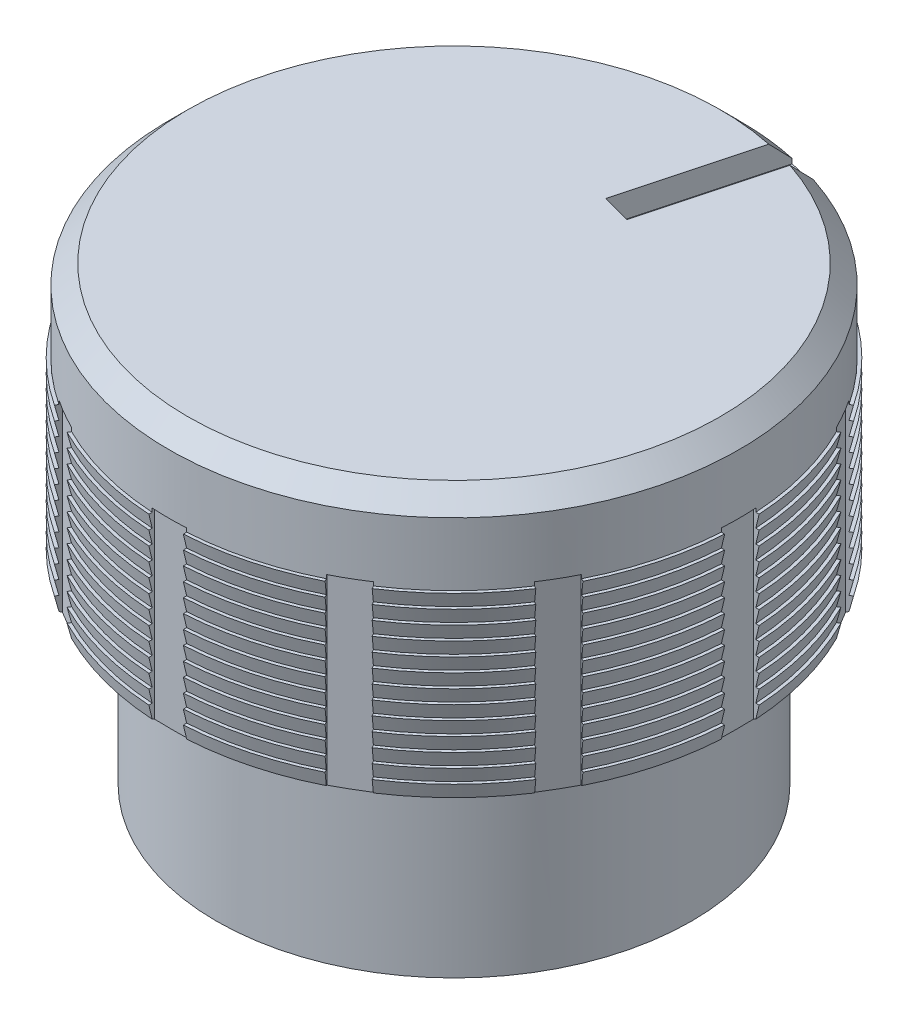
from build123d import *

# Parameters (mm, degrees)
CUT_EXTRUDE_START   = -1.65
SKETCH_3_W          = 0.725430778
SKETCH_3_H          = 1.01974488
SKETCH_3_W_2        = 1.01974488
SKETCH_3_H_2        = 0.725430778
CUT_EXTRUDE_1_DEPTH = 10.35
CHAMFER_1_SIZE      = 0.4
CUT_EXTRUDE_2_DEPTH = 0.5
CUT_EXTRUDE_3_DEPTH = 5


with BuildPart() as part:
    # Эскиз2 → Повернуть1 (revolve)
    with BuildSketch(Plane.XY, mode=Mode.PRIVATE) as revolve_1_sk:
        Polygon((0, 12.425316518), (0, 11.425316518), (2.6, 11.425316518), (2.6, 6.425316518), (3.724689456, 6.425316518), (3.724689456, 2.931277974), (5, 2.931277974), (5, 6.425316518), (6, 6.925316518), (6.07, 7.218411602), (6.0007392, 7.218411602), (6.07, 7.508411602), (6.0007392, 7.508411602), (6.07, 7.798411602), (6.0007392, 7.798411602), (6.07, 8.088411602), (6.0007392, 8.088411602), (6.07, 8.378411602), (6.0007392, 8.378411602), (6.07, 8.668411602), (6.0007392, 8.668411602), (6.07, 8.958411602), (6.0007392, 8.958411602), (6.07, 9.248411602), (6.0007392, 9.248411602), (6.07, 9.538411602), (6.0007392, 9.538411602), (6.07, 9.828411602), (6.0007392, 9.828411602), (6.07, 10.118411602), (6.0007392, 10.118411602), (6.07, 10.408411602), (6.0007392, 10.408411602), (6.07, 10.698411602), (6.0007392, 10.698411602), (6, 10.695316518), (6, 10.698411602), (6, 10.76026554), (6, 10.985316518), (6, 10.988411602), (6, 11.275316518), (6, 11.278411602), (6, 11.565316518), (6, 11.568411602), (6, 11.855316518), (6, 11.858411602), (6, 12.145316518), (6, 12.148411602), (6, 12.425316518), align=None)
    revolve(revolve_1_sk.sketch.rotate(Axis((0, 0, 0), (0, 1, 0)), 90), axis=Axis((0, 0, 0), (0, 1, 0)))

    # Эскиз3 → Вырез-Вытянуть1 (cut)
    with BuildSketch(Plane(origin=(0, 12.425316518, 0), x_dir=(1, 0, 0), z_dir=(0, 1, 0)).offset(CUT_EXTRUDE_START)):
        with Locations((0, 6.446440486)):
            Rectangle(SKETCH_3_W, SKETCH_3_H)
        Polygon((3.792277205, 5.842986016), (3.164035722, 6.205701405), (2.654163282, 5.322576434), (3.282404764, 4.959861044), align=None)
        Polygon((6.205701405, 3.164035722), (5.842986016, 3.792277205), (4.959861044, 3.282404764), (5.322576434, 2.654163282), align=None)
        with Locations((6.446440486, 0)):
            Rectangle(SKETCH_3_W_2, SKETCH_3_H_2)
        Polygon((5.842986016, -3.792277205), (6.205701405, -3.164035722), (5.322576434, -2.654163282), (4.959861044, -3.282404764), align=None)
        Polygon((3.164035722, -6.205701405), (3.792277205, -5.842986016), (3.282404764, -4.959861044), (2.654163282, -5.322576434), align=None)
        with Locations((0, -6.446440486)):
            Rectangle(SKETCH_3_W, SKETCH_3_H)
        Polygon((-3.792277205, -5.842986016), (-3.164035722, -6.205701405), (-2.654163282, -5.322576434), (-3.282404764, -4.959861044), align=None)
        Polygon((-6.205701405, -3.164035722), (-5.842986016, -3.792277205), (-4.959861044, -3.282404764), (-5.322576434, -2.654163282), align=None)
        with Locations((-6.446440486, 0)):
            Rectangle(SKETCH_3_W_2, SKETCH_3_H_2)
        Polygon((-5.842986016, 3.792277205), (-6.205701405, 3.164035722), (-5.322576434, 2.654163282), (-4.959861044, 3.282404764), align=None)
        Polygon((-3.164035722, 6.205701405), (-3.792277205, 5.842986016), (-3.282404764, 4.959861044), (-2.654163282, 5.322576434), align=None)
    extrude(amount=-CUT_EXTRUDE_1_DEPTH, mode=Mode.SUBTRACT)

    # Фаска1
    chamfer_1_edges = [part.edges().sort_by_distance(p)[0] for p in [
        (0, 12.425316518, 6),
    ]]
    chamfer(chamfer_1_edges, length=CHAMFER_1_SIZE)

    # Эскиз4 → Вырез-Вытянуть2 (cut)
    with BuildSketch(Plane(origin=(0, 12.425316518, 0), x_dir=(1, 0, 0), z_dir=(0, 1, 0))):
        Polygon((1.024833322, 2.61357221), (0.419254413, 2.775836589), (1.295979843, 6.047820439), (1.901558753, 5.88555606), align=None)
    extrude(amount=-CUT_EXTRUDE_2_DEPTH, mode=Mode.SUBTRACT)

    # Эскиз5 → Вырез-Вытянуть3 (cut)
    with BuildSketch(Plane.XZ.offset(-6.425316518)):
        Polygon((0.356179565, 2.81358882), (-0.356179565, 2.81358882), (-0.50519653, 2.550446327), (0, 2.438119961), (0.50519653, 2.550446327), align=None)
        Polygon((1.622921263, 2.325784277), (0.992158579, 2.656834071), (0.737922195, 2.493084602), (1.133050842, 2.15884801), (1.632580819, 2.023531534), align=None)
        Polygon((2.517871258, 1.305170585), (2.113205149, 1.891430656), (1.811991839, 1.86458724), (2.006533391, 1.385009998), (2.385960517, 1.033050053), align=None)
        Polygon((2.836007292, -0.014441959), (2.750141887, 0.692723271), (2.470955989, 0.808935412), (2.420343321, 0.293882886), (2.592745414, -0.194090745), align=None)
        Polygon((2.504448232, -1.330746024), (2.757054261, -0.664678667), (2.5638539, -0.43203377), (2.279681765, -0.864569253), (2.205563583, -1.376767693), align=None)
        Polygon((1.599150264, -2.342192213), (2.13235873, -1.869810732), (2.069403781, -1.574029222), (1.616772589, -1.824958996), (1.313113715, -2.244043754), align=None)
        Polygon((0.327506243, -2.817070391), (1.019165512, -2.646591693), (1.100878194, -2.355433549), (0.583480298, -2.367272626), (0.11984532, -2.597236435), align=None)
        Polygon((-1.019165512, -2.646591693), (-0.327506243, -2.817070391), (-0.11984532, -2.597236435), (-0.583480298, -2.367272626), (-1.100878194, -2.355433549), align=None)
        Polygon((-2.13235873, -1.869810732), (-1.599150264, -2.342192213), (-1.313113715, -2.244043754), (-1.616772589, -1.824958996), (-2.069403781, -1.574029222), align=None)
        Polygon((-2.757054261, -0.664678667), (-2.504448232, -1.330746024), (-2.205563583, -1.376767693), (-2.279681765, -0.864569253), (-2.5638539, -0.43203377), align=None)
        Polygon((-2.750141887, 0.692723271), (-2.836007292, -0.014441959), (-2.592745414, -0.194090745), (-2.420343321, 0.293882886), (-2.470955989, 0.808935412), align=None)
        Polygon((-2.113205149, 1.891430656), (-2.517871258, 1.305170585), (-2.385960517, 1.033050053), (-2.006533391, 1.385009998), (-1.811991839, 1.86458724), align=None)
        Polygon((-0.992158579, 2.656834071), (-1.622921263, 2.325784277), (-1.632580819, 2.023531534), (-1.133050842, 2.15884801), (-0.737922195, 2.493084602), align=None)
    extrude(amount=-CUT_EXTRUDE_3_DEPTH, mode=Mode.SUBTRACT)


solid = part.part
